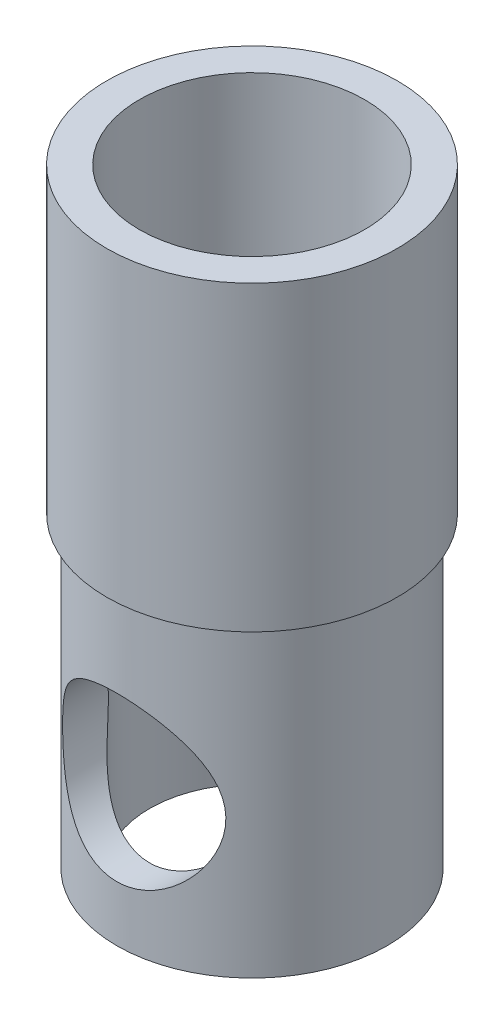
from build123d import *

# Parameters (mm, degrees)
BOSS_EXTRUDE1_DEPTH      = 1
BOSS_EXTRUDE1_DEPTH_BACK = 17.8
SKETCH1_R                = 8.28
SKETCH1_R_2              = 6.28
SKETCH2_R                = 8.9
SKETCH2_R_2              = 6.9
BOSS_EXTRUDE2_DEPTH      = 18.5
SKETCH3_R                = 5
CUT_EXTRUDE1_DEPTH       = 24.209265391


with BuildPart() as part:
    # Sketch1 → Boss-Extrude1 (new, two sides: drawn at the far end of the back side and taken through both)
    with BuildSketch(Plane(origin=(0, 0, 0), x_dir=(1, 0, 0), z_dir=(0, 1, 0)).offset(-BOSS_EXTRUDE1_DEPTH_BACK)):
        with Locations(Location((0, 0, 0), (0, 0, 270))):
            Circle(SKETCH1_R)
        with Locations(Location((0, 0, 0), (0, 0, 270))):
            Circle(SKETCH1_R_2, mode=Mode.SUBTRACT)
    extrude(amount=BOSS_EXTRUDE1_DEPTH + BOSS_EXTRUDE1_DEPTH_BACK)

    # Sketch2 → Boss-Extrude2 (add)
    with BuildSketch(Plane(origin=(0, 1, 0), x_dir=(1, 0, 0), z_dir=(0, 1, 0))):
        with Locations(Location((0, 0, 0), (0, 0, 270))):
            Circle(SKETCH2_R)
        with Locations(Location((0, 0, 0), (0, 0, 270))):
            Circle(SKETCH2_R_2, mode=Mode.SUBTRACT)
    extrude(amount=BOSS_EXTRUDE2_DEPTH)

    # Sketch3 → Cut-Extrude1 (cut, through all)
    with BuildSketch(Plane.XY):
        with Locations(Location((0, -9.4, 0), (0, 0, 90.000000004))):
            Circle(SKETCH3_R)
    extrude(amount=CUT_EXTRUDE1_DEPTH, mode=Mode.SUBTRACT)


solid = part.part
